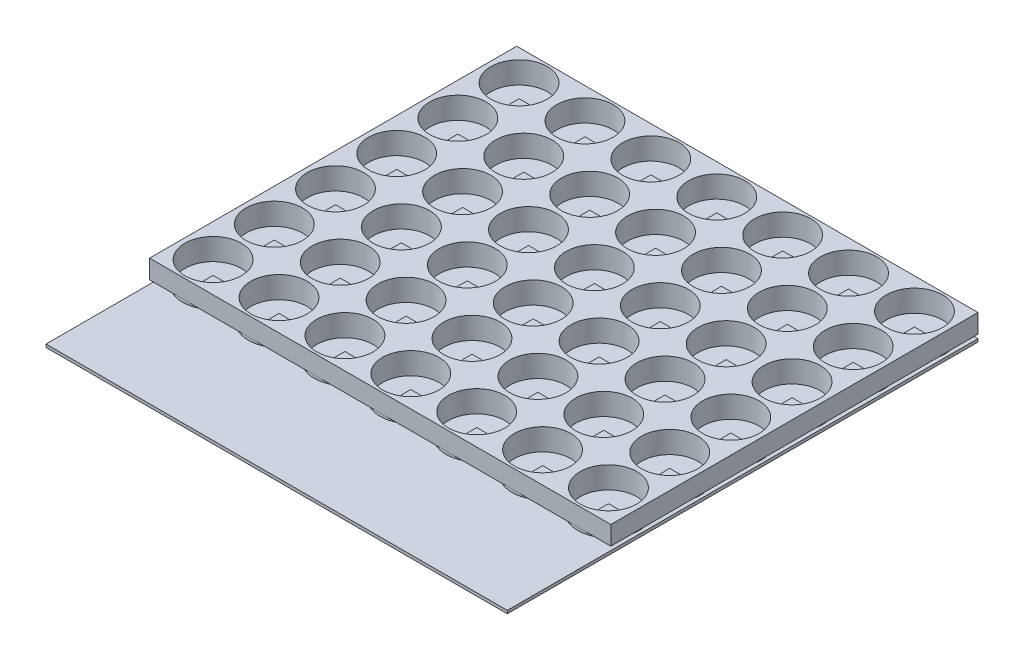
from build123d import *

# Parameters (mm, degrees)
SKETCH1_W           = 245
SKETCH1_H           = 250
BOSS_EXTRUDE1_DEPTH = 1.6
SKETCH2_W           = 5.4
SKETCH2_H           = 5.4
BOSS_EXTRUDE2_DEPTH = 2
SKETCH3_W           = 245
SKETCH3_H           = 195
SKETCH3_R           = 15
BOSS_EXTRUDE3_DEPTH = 10
SKETCH4_R           = 16.2
SKETCH4_R_2         = 15
BOSS_EXTRUDE4_DEPTH = 1.6


with BuildPart() as part:
    # Sketch1 → Boss-Extrude1 (new body)
    with BuildSketch(Plane(origin=(0, 0, 0), x_dir=(1, 0, 0), z_dir=(0, 1, 0))):
        Rectangle(SKETCH1_W, SKETCH1_H)
    extrude(amount=BOSS_EXTRUDE1_DEPTH)

    # Sketch2 → Boss-Extrude2 (add)
    with BuildSketch(Plane(origin=(0, 1.6, 0), x_dir=(1, 0, 0), z_dir=(0, 1, 0))):
        with Locations((-105, 108.75)):
            Rectangle(SKETCH2_W, SKETCH2_H)
        with Locations((-70, 108.75)):
            Rectangle(SKETCH2_W, SKETCH2_H)
        with Locations((-35, 108.75)):
            Rectangle(SKETCH2_W, SKETCH2_H)
        with Locations((0, 108.75)):
            Rectangle(SKETCH2_W, SKETCH2_H)
        with Locations((35, 108.75)):
            Rectangle(SKETCH2_W, SKETCH2_H)
        with Locations((70, 108.75)):
            Rectangle(SKETCH2_W, SKETCH2_H)
        with Locations((105, 108.75)):
            Rectangle(SKETCH2_W, SKETCH2_H)
        with Locations((-70, 76.25)):
            Rectangle(SKETCH2_W, SKETCH2_H)
        with Locations((-35, 76.25)):
            Rectangle(SKETCH2_W, SKETCH2_H)
        with Locations((0, 76.25)):
            Rectangle(SKETCH2_W, SKETCH2_H)
        with Locations((35, 76.25)):
            Rectangle(SKETCH2_W, SKETCH2_H)
        with Locations((70, 76.25)):
            Rectangle(SKETCH2_W, SKETCH2_H)
        with Locations((105, 76.25)):
            Rectangle(SKETCH2_W, SKETCH2_H)
        with Locations((-70, 43.75)):
            Rectangle(SKETCH2_W, SKETCH2_H)
        with Locations((-35, 43.75)):
            Rectangle(SKETCH2_W, SKETCH2_H)
        with Locations((0, 43.75)):
            Rectangle(SKETCH2_W, SKETCH2_H)
        with Locations((35, 43.75)):
            Rectangle(SKETCH2_W, SKETCH2_H)
        with Locations((70, 43.75)):
            Rectangle(SKETCH2_W, SKETCH2_H)
        with Locations((105, 43.75)):
            Rectangle(SKETCH2_W, SKETCH2_H)
        with Locations((-70, 11.25)):
            Rectangle(SKETCH2_W, SKETCH2_H)
        with Locations((-35, 11.25)):
            Rectangle(SKETCH2_W, SKETCH2_H)
        with Locations((0, 11.25)):
            Rectangle(SKETCH2_W, SKETCH2_H)
        with Locations((35, 11.25)):
            Rectangle(SKETCH2_W, SKETCH2_H)
        with Locations((70, 11.25)):
            Rectangle(SKETCH2_W, SKETCH2_H)
        with Locations((105, 11.25)):
            Rectangle(SKETCH2_W, SKETCH2_H)
        with Locations((-70, -21.25)):
            Rectangle(SKETCH2_W, SKETCH2_H)
        with Locations((-35, -21.25)):
            Rectangle(SKETCH2_W, SKETCH2_H)
        with Locations((0, -21.25)):
            Rectangle(SKETCH2_W, SKETCH2_H)
        with Locations((35, -21.25)):
            Rectangle(SKETCH2_W, SKETCH2_H)
        with Locations((70, -21.25)):
            Rectangle(SKETCH2_W, SKETCH2_H)
        with Locations((105, -21.25)):
            Rectangle(SKETCH2_W, SKETCH2_H)
        with Locations((-70, -53.75)):
            Rectangle(SKETCH2_W, SKETCH2_H)
        with Locations((-35, -53.75)):
            Rectangle(SKETCH2_W, SKETCH2_H)
        with Locations((0, -53.75)):
            Rectangle(SKETCH2_W, SKETCH2_H)
        with Locations((35, -53.75)):
            Rectangle(SKETCH2_W, SKETCH2_H)
        with Locations((70, -53.75)):
            Rectangle(SKETCH2_W, SKETCH2_H)
        with Locations((105, -53.75)):
            Rectangle(SKETCH2_W, SKETCH2_H)
        with Locations((-105, 76.25)):
            Rectangle(SKETCH2_W, SKETCH2_H)
        with Locations((-105, 43.75)):
            Rectangle(SKETCH2_W, SKETCH2_H)
        with Locations((-105, 11.25)):
            Rectangle(SKETCH2_W, SKETCH2_H)
        with Locations((-105, -21.25)):
            Rectangle(SKETCH2_W, SKETCH2_H)
        with Locations((-105, -53.75)):
            Rectangle(SKETCH2_W, SKETCH2_H)
    extrude(amount=BOSS_EXTRUDE2_DEPTH)


with BuildPart() as body_2:
    # Sketch3 → Boss-Extrude3 (new body)
    with BuildSketch(Plane(origin=(0, 3.6, 0), x_dir=(1, 0, 0), z_dir=(0, 1, 0))):
        with Locations((0, 27.5)):
            Rectangle(SKETCH3_W, SKETCH3_H)
        with Locations(Location((105, -53.75, 0), (0, 0, 270))):
            Circle(SKETCH3_R, mode=Mode.SUBTRACT)
        with Locations(Location((70, -53.75, 0), (0, 0, 270))):
            Circle(SKETCH3_R, mode=Mode.SUBTRACT)
        with Locations(Location((35, -53.75, 0), (0, 0, 270))):
            Circle(SKETCH3_R, mode=Mode.SUBTRACT)
        with Locations(Location((0, -53.75, 0), (0, 0, 270))):
            Circle(SKETCH3_R, mode=Mode.SUBTRACT)
        with Locations(Location((-35, -53.75, 0), (0, 0, 270))):
            Circle(SKETCH3_R, mode=Mode.SUBTRACT)
        with Locations(Location((-70, -53.75, 0), (0, 0, 270))):
            Circle(SKETCH3_R, mode=Mode.SUBTRACT)
        with Locations(Location((-105, -53.75, 0), (0, 0, 270))):
            Circle(SKETCH3_R, mode=Mode.SUBTRACT)
        with Locations(Location((70, -21.25, 0), (0, 0, 270))):
            Circle(SKETCH3_R, mode=Mode.SUBTRACT)
        with Locations(Location((35, -21.25, 0), (0, 0, 270))):
            Circle(SKETCH3_R, mode=Mode.SUBTRACT)
        with Locations(Location((0, -21.25, 0), (0, 0, 270))):
            Circle(SKETCH3_R, mode=Mode.SUBTRACT)
        with Locations(Location((-35, -21.25, 0), (0, 0, 270))):
            Circle(SKETCH3_R, mode=Mode.SUBTRACT)
        with Locations(Location((-70, -21.25, 0), (0, 0, 270))):
            Circle(SKETCH3_R, mode=Mode.SUBTRACT)
        with Locations(Location((-105, -21.25, 0), (0, 0, 270))):
            Circle(SKETCH3_R, mode=Mode.SUBTRACT)
        with Locations(Location((70, 11.25, 0), (0, 0, 270))):
            Circle(SKETCH3_R, mode=Mode.SUBTRACT)
        with Locations(Location((35, 11.25, 0), (0, 0, 270))):
            Circle(SKETCH3_R, mode=Mode.SUBTRACT)
        with Locations(Location((0, 11.25, 0), (0, 0, 270))):
            Circle(SKETCH3_R, mode=Mode.SUBTRACT)
        with Locations(Location((-35, 11.25, 0), (0, 0, 270))):
            Circle(SKETCH3_R, mode=Mode.SUBTRACT)
        with Locations(Location((-70, 11.25, 0), (0, 0, 270))):
            Circle(SKETCH3_R, mode=Mode.SUBTRACT)
        with Locations(Location((-105, 11.25, 0), (0, 0, 270))):
            Circle(SKETCH3_R, mode=Mode.SUBTRACT)
        with Locations(Location((70, 43.75, 0), (0, 0, 270))):
            Circle(SKETCH3_R, mode=Mode.SUBTRACT)
        with Locations(Location((35, 43.75, 0), (0, 0, 270))):
            Circle(SKETCH3_R, mode=Mode.SUBTRACT)
        with Locations(Location((0, 43.75, 0), (0, 0, 270))):
            Circle(SKETCH3_R, mode=Mode.SUBTRACT)
        with Locations(Location((-35, 43.75, 0), (0, 0, 270))):
            Circle(SKETCH3_R, mode=Mode.SUBTRACT)
        with Locations(Location((-70, 43.75, 0), (0, 0, 270))):
            Circle(SKETCH3_R, mode=Mode.SUBTRACT)
        with Locations(Location((-105, 43.75, 0), (0, 0, 270))):
            Circle(SKETCH3_R, mode=Mode.SUBTRACT)
        with Locations(Location((70, 76.25, 0), (0, 0, 270))):
            Circle(SKETCH3_R, mode=Mode.SUBTRACT)
        with Locations(Location((35, 76.25, 0), (0, 0, 270))):
            Circle(SKETCH3_R, mode=Mode.SUBTRACT)
        with Locations(Location((0, 76.25, 0), (0, 0, 270))):
            Circle(SKETCH3_R, mode=Mode.SUBTRACT)
        with Locations(Location((-35, 76.25, 0), (0, 0, 270))):
            Circle(SKETCH3_R, mode=Mode.SUBTRACT)
        with Locations(Location((-70, 76.25, 0), (0, 0, 270))):
            Circle(SKETCH3_R, mode=Mode.SUBTRACT)
        with Locations(Location((-105, 76.25, 0), (0, 0, 270))):
            Circle(SKETCH3_R, mode=Mode.SUBTRACT)
        with Locations(Location((70, 108.75, 0), (0, 0, 270))):
            Circle(SKETCH3_R, mode=Mode.SUBTRACT)
        with Locations(Location((35, 108.75, 0), (0, 0, 270))):
            Circle(SKETCH3_R, mode=Mode.SUBTRACT)
        with Locations(Location((0, 108.75, 0), (0, 0, 270))):
            Circle(SKETCH3_R, mode=Mode.SUBTRACT)
        with Locations(Location((-35, 108.75, 0), (0, 0, 270))):
            Circle(SKETCH3_R, mode=Mode.SUBTRACT)
        with Locations(Location((-70, 108.75, 0), (0, 0, 270))):
            Circle(SKETCH3_R, mode=Mode.SUBTRACT)
        with Locations(Location((-105, 108.75, 0), (0, 0, 270))):
            Circle(SKETCH3_R, mode=Mode.SUBTRACT)
        with Locations(Location((105, -21.25, 0), (0, 0, 270))):
            Circle(SKETCH3_R, mode=Mode.SUBTRACT)
        with Locations(Location((105, 11.25, 0), (0, 0, 270))):
            Circle(SKETCH3_R, mode=Mode.SUBTRACT)
        with Locations(Location((105, 43.75, 0), (0, 0, 270))):
            Circle(SKETCH3_R, mode=Mode.SUBTRACT)
        with Locations(Location((105, 76.25, 0), (0, 0, 270))):
            Circle(SKETCH3_R, mode=Mode.SUBTRACT)
        with Locations(Location((105, 108.75, 0), (0, 0, 270))):
            Circle(SKETCH3_R, mode=Mode.SUBTRACT)
    extrude(amount=BOSS_EXTRUDE3_DEPTH)

    # Sketch4 → Boss-Extrude4 (add)
    # profile 1 of 42: a face of its own
    with BuildSketch(Plane(origin=(0, 3.6, 0), x_dir=(-1, 0, 0), z_dir=(0, -1, 0))):
        with Locations(Location((105, 108.75, 0), (0, 0, 270))):
            Circle(SKETCH4_R)
        with Locations(Location((105, 108.75, 0), (0, 0, 90))):
            Circle(SKETCH4_R_2, mode=Mode.SUBTRACT)
    # profile 2 of 42: a face of its own
    with BuildSketch(Plane(origin=(0, 3.6, 0), x_dir=(-1, 0, 0), z_dir=(0, -1, 0))):
        with Locations(Location((70, 108.75, 0), (0, 0, 270))):
            Circle(SKETCH4_R)
        with Locations(Location((70, 108.75, 0), (0, 0, 90))):
            Circle(SKETCH4_R_2, mode=Mode.SUBTRACT)
    # profile 3 of 42: a face of its own
    with BuildSketch(Plane(origin=(0, 3.6, 0), x_dir=(-1, 0, 0), z_dir=(0, -1, 0))):
        with Locations(Location((35, 108.75, 0), (0, 0, 270))):
            Circle(SKETCH4_R)
        with Locations(Location((35, 108.75, 0), (0, 0, 90))):
            Circle(SKETCH4_R_2, mode=Mode.SUBTRACT)
    # profile 4 of 42: a face of its own
    with BuildSketch(Plane(origin=(0, 3.6, 0), x_dir=(-1, 0, 0), z_dir=(0, -1, 0))):
        with Locations(Location((0, 108.75, 0), (0, 0, 270))):
            Circle(SKETCH4_R)
        with Locations(Location((0, 108.75, 0), (0, 0, 90))):
            Circle(SKETCH4_R_2, mode=Mode.SUBTRACT)
    # profile 5 of 42: a face of its own
    with BuildSketch(Plane(origin=(0, 3.6, 0), x_dir=(-1, 0, 0), z_dir=(0, -1, 0))):
        with Locations(Location((-35, 108.75, 0), (0, 0, 270))):
            Circle(SKETCH4_R)
        with Locations(Location((-35, 108.75, 0), (0, 0, 90))):
            Circle(SKETCH4_R_2, mode=Mode.SUBTRACT)
    # profile 6 of 42: a face of its own
    with BuildSketch(Plane(origin=(0, 3.6, 0), x_dir=(-1, 0, 0), z_dir=(0, -1, 0))):
        with Locations(Location((-70, 108.75, 0), (0, 0, 270))):
            Circle(SKETCH4_R)
        with Locations(Location((-70, 108.75, 0), (0, 0, 90))):
            Circle(SKETCH4_R_2, mode=Mode.SUBTRACT)
    # profile 7 of 42: a face of its own
    with BuildSketch(Plane(origin=(0, 3.6, 0), x_dir=(-1, 0, 0), z_dir=(0, -1, 0))):
        with Locations(Location((-105, 108.75, 0), (0, 0, 270))):
            Circle(SKETCH4_R)
        with Locations(Location((-105, 108.75, 0), (0, 0, 90))):
            Circle(SKETCH4_R_2, mode=Mode.SUBTRACT)
    # profile 8 of 42: a face of its own
    with BuildSketch(Plane(origin=(0, 3.6, 0), x_dir=(-1, 0, 0), z_dir=(0, -1, 0))):
        with Locations(Location((70, 76.25, 0), (0, 0, 270))):
            Circle(SKETCH4_R)
        with Locations(Location((70, 76.25, 0), (0, 0, 90))):
            Circle(SKETCH4_R_2, mode=Mode.SUBTRACT)
    # profile 9 of 42: a face of its own
    with BuildSketch(Plane(origin=(0, 3.6, 0), x_dir=(-1, 0, 0), z_dir=(0, -1, 0))):
        with Locations(Location((35, 76.25, 0), (0, 0, 270))):
            Circle(SKETCH4_R)
        with Locations(Location((35, 76.25, 0), (0, 0, 90))):
            Circle(SKETCH4_R_2, mode=Mode.SUBTRACT)
    # profile 10 of 42: a face of its own
    with BuildSketch(Plane(origin=(0, 3.6, 0), x_dir=(-1, 0, 0), z_dir=(0, -1, 0))):
        with Locations(Location((0, 76.25, 0), (0, 0, 270))):
            Circle(SKETCH4_R)
        with Locations(Location((0, 76.25, 0), (0, 0, 90))):
            Circle(SKETCH4_R_2, mode=Mode.SUBTRACT)
    # profile 11 of 42: a face of its own
    with BuildSketch(Plane(origin=(0, 3.6, 0), x_dir=(-1, 0, 0), z_dir=(0, -1, 0))):
        with Locations(Location((-35, 76.25, 0), (0, 0, 270))):
            Circle(SKETCH4_R)
        with Locations(Location((-35, 76.25, 0), (0, 0, 90))):
            Circle(SKETCH4_R_2, mode=Mode.SUBTRACT)
    # profile 12 of 42: a face of its own
    with BuildSketch(Plane(origin=(0, 3.6, 0), x_dir=(-1, 0, 0), z_dir=(0, -1, 0))):
        with Locations(Location((-70, 76.25, 0), (0, 0, 270))):
            Circle(SKETCH4_R)
        with Locations(Location((-70, 76.25, 0), (0, 0, 90))):
            Circle(SKETCH4_R_2, mode=Mode.SUBTRACT)
    # profile 13 of 42: a face of its own
    with BuildSketch(Plane(origin=(0, 3.6, 0), x_dir=(-1, 0, 0), z_dir=(0, -1, 0))):
        with Locations(Location((-105, 76.25, 0), (0, 0, 270))):
            Circle(SKETCH4_R)
        with Locations(Location((-105, 76.25, 0), (0, 0, 90))):
            Circle(SKETCH4_R_2, mode=Mode.SUBTRACT)
    # profile 14 of 42: a face of its own
    with BuildSketch(Plane(origin=(0, 3.6, 0), x_dir=(-1, 0, 0), z_dir=(0, -1, 0))):
        with Locations(Location((70, 43.75, 0), (0, 0, 270))):
            Circle(SKETCH4_R)
        with Locations(Location((70, 43.75, 0), (0, 0, 90))):
            Circle(SKETCH4_R_2, mode=Mode.SUBTRACT)
    # profile 15 of 42: a face of its own
    with BuildSketch(Plane(origin=(0, 3.6, 0), x_dir=(-1, 0, 0), z_dir=(0, -1, 0))):
        with Locations(Location((35, 43.75, 0), (0, 0, 270))):
            Circle(SKETCH4_R)
        with Locations(Location((35, 43.75, 0), (0, 0, 90))):
            Circle(SKETCH4_R_2, mode=Mode.SUBTRACT)
    # profile 16 of 42: a face of its own
    with BuildSketch(Plane(origin=(0, 3.6, 0), x_dir=(-1, 0, 0), z_dir=(0, -1, 0))):
        with Locations(Location((0, 43.75, 0), (0, 0, 270))):
            Circle(SKETCH4_R)
        with Locations(Location((0, 43.75, 0), (0, 0, 90))):
            Circle(SKETCH4_R_2, mode=Mode.SUBTRACT)
    # profile 17 of 42: a face of its own
    with BuildSketch(Plane(origin=(0, 3.6, 0), x_dir=(-1, 0, 0), z_dir=(0, -1, 0))):
        with Locations(Location((-35, 43.75, 0), (0, 0, 270))):
            Circle(SKETCH4_R)
        with Locations(Location((-35, 43.75, 0), (0, 0, 90))):
            Circle(SKETCH4_R_2, mode=Mode.SUBTRACT)
    # profile 18 of 42: a face of its own
    with BuildSketch(Plane(origin=(0, 3.6, 0), x_dir=(-1, 0, 0), z_dir=(0, -1, 0))):
        with Locations(Location((-70, 43.75, 0), (0, 0, 270))):
            Circle(SKETCH4_R)
        with Locations(Location((-70, 43.75, 0), (0, 0, 90))):
            Circle(SKETCH4_R_2, mode=Mode.SUBTRACT)
    # profile 19 of 42: a face of its own
    with BuildSketch(Plane(origin=(0, 3.6, 0), x_dir=(-1, 0, 0), z_dir=(0, -1, 0))):
        with Locations(Location((-105, 43.75, 0), (0, 0, 270))):
            Circle(SKETCH4_R)
        with Locations(Location((-105, 43.75, 0), (0, 0, 90))):
            Circle(SKETCH4_R_2, mode=Mode.SUBTRACT)
    # profile 20 of 42: a face of its own
    with BuildSketch(Plane(origin=(0, 3.6, 0), x_dir=(-1, 0, 0), z_dir=(0, -1, 0))):
        with Locations(Location((70, 11.25, 0), (0, 0, 270))):
            Circle(SKETCH4_R)
        with Locations(Location((70, 11.25, 0), (0, 0, 90))):
            Circle(SKETCH4_R_2, mode=Mode.SUBTRACT)
    # profile 21 of 42: a face of its own
    with BuildSketch(Plane(origin=(0, 3.6, 0), x_dir=(-1, 0, 0), z_dir=(0, -1, 0))):
        with Locations(Location((35, 11.25, 0), (0, 0, 270))):
            Circle(SKETCH4_R)
        with Locations(Location((35, 11.25, 0), (0, 0, 90))):
            Circle(SKETCH4_R_2, mode=Mode.SUBTRACT)
    # profile 22 of 42: a face of its own
    with BuildSketch(Plane(origin=(0, 3.6, 0), x_dir=(-1, 0, 0), z_dir=(0, -1, 0))):
        with Locations(Location((0, 11.25, 0), (0, 0, 270))):
            Circle(SKETCH4_R)
        with Locations(Location((0, 11.25, 0), (0, 0, 90))):
            Circle(SKETCH4_R_2, mode=Mode.SUBTRACT)
    # profile 23 of 42: a face of its own
    with BuildSketch(Plane(origin=(0, 3.6, 0), x_dir=(-1, 0, 0), z_dir=(0, -1, 0))):
        with Locations(Location((-35, 11.25, 0), (0, 0, 270))):
            Circle(SKETCH4_R)
        with Locations(Location((-35, 11.25, 0), (0, 0, 90))):
            Circle(SKETCH4_R_2, mode=Mode.SUBTRACT)
    # profile 24 of 42: a face of its own
    with BuildSketch(Plane(origin=(0, 3.6, 0), x_dir=(-1, 0, 0), z_dir=(0, -1, 0))):
        with Locations(Location((-70, 11.25, 0), (0, 0, 270))):
            Circle(SKETCH4_R)
        with Locations(Location((-70, 11.25, 0), (0, 0, 90))):
            Circle(SKETCH4_R_2, mode=Mode.SUBTRACT)
    # profile 25 of 42: a face of its own
    with BuildSketch(Plane(origin=(0, 3.6, 0), x_dir=(-1, 0, 0), z_dir=(0, -1, 0))):
        with Locations(Location((-105, 11.25, 0), (0, 0, 270))):
            Circle(SKETCH4_R)
        with Locations(Location((-105, 11.25, 0), (0, 0, 90))):
            Circle(SKETCH4_R_2, mode=Mode.SUBTRACT)
    # profile 26 of 42: a face of its own
    with BuildSketch(Plane(origin=(0, 3.6, 0), x_dir=(-1, 0, 0), z_dir=(0, -1, 0))):
        with Locations(Location((70, -21.25, 0), (0, 0, 270))):
            Circle(SKETCH4_R)
        with Locations(Location((70, -21.25, 0), (0, 0, 90))):
            Circle(SKETCH4_R_2, mode=Mode.SUBTRACT)
    # profile 27 of 42: a face of its own
    with BuildSketch(Plane(origin=(0, 3.6, 0), x_dir=(-1, 0, 0), z_dir=(0, -1, 0))):
        with Locations(Location((35, -21.25, 0), (0, 0, 270))):
            Circle(SKETCH4_R)
        with Locations(Location((35, -21.25, 0), (0, 0, 90))):
            Circle(SKETCH4_R_2, mode=Mode.SUBTRACT)
    # profile 28 of 42: a face of its own
    with BuildSketch(Plane(origin=(0, 3.6, 0), x_dir=(-1, 0, 0), z_dir=(0, -1, 0))):
        with Locations(Location((0, -21.25, 0), (0, 0, 270))):
            Circle(SKETCH4_R)
        with Locations(Location((0, -21.25, 0), (0, 0, 90))):
            Circle(SKETCH4_R_2, mode=Mode.SUBTRACT)
    # profile 29 of 42: a face of its own
    with BuildSketch(Plane(origin=(0, 3.6, 0), x_dir=(-1, 0, 0), z_dir=(0, -1, 0))):
        with Locations(Location((-35, -21.25, 0), (0, 0, 270))):
            Circle(SKETCH4_R)
        with Locations(Location((-35, -21.25, 0), (0, 0, 90))):
            Circle(SKETCH4_R_2, mode=Mode.SUBTRACT)
    # profile 30 of 42: a face of its own
    with BuildSketch(Plane(origin=(0, 3.6, 0), x_dir=(-1, 0, 0), z_dir=(0, -1, 0))):
        with Locations(Location((-70, -21.25, 0), (0, 0, 270))):
            Circle(SKETCH4_R)
        with Locations(Location((-70, -21.25, 0), (0, 0, 90))):
            Circle(SKETCH4_R_2, mode=Mode.SUBTRACT)
    # profile 31 of 42: a face of its own
    with BuildSketch(Plane(origin=(0, 3.6, 0), x_dir=(-1, 0, 0), z_dir=(0, -1, 0))):
        with Locations(Location((-105, -21.25, 0), (0, 0, 270))):
            Circle(SKETCH4_R)
        with Locations(Location((-105, -21.25, 0), (0, 0, 90))):
            Circle(SKETCH4_R_2, mode=Mode.SUBTRACT)
    # profile 32 of 42: a face of its own
    with BuildSketch(Plane(origin=(0, 3.6, 0), x_dir=(-1, 0, 0), z_dir=(0, -1, 0))):
        with Locations(Location((70, -53.75, 0), (0, 0, 270))):
            Circle(SKETCH4_R)
        with Locations(Location((70, -53.75, 0), (0, 0, 90))):
            Circle(SKETCH4_R_2, mode=Mode.SUBTRACT)
    # profile 33 of 42: a face of its own
    with BuildSketch(Plane(origin=(0, 3.6, 0), x_dir=(-1, 0, 0), z_dir=(0, -1, 0))):
        with Locations(Location((35, -53.75, 0), (0, 0, 270))):
            Circle(SKETCH4_R)
        with Locations(Location((35, -53.75, 0), (0, 0, 90))):
            Circle(SKETCH4_R_2, mode=Mode.SUBTRACT)
    # profile 34 of 42: a face of its own
    with BuildSketch(Plane(origin=(0, 3.6, 0), x_dir=(-1, 0, 0), z_dir=(0, -1, 0))):
        with Locations(Location((0, -53.75, 0), (0, 0, 270))):
            Circle(SKETCH4_R)
        with Locations(Location((0, -53.75, 0), (0, 0, 90))):
            Circle(SKETCH4_R_2, mode=Mode.SUBTRACT)
    # profile 35 of 42: a face of its own
    with BuildSketch(Plane(origin=(0, 3.6, 0), x_dir=(-1, 0, 0), z_dir=(0, -1, 0))):
        with Locations(Location((-35, -53.75, 0), (0, 0, 270))):
            Circle(SKETCH4_R)
        with Locations(Location((-35, -53.75, 0), (0, 0, 90))):
            Circle(SKETCH4_R_2, mode=Mode.SUBTRACT)
    # profile 36 of 42: a face of its own
    with BuildSketch(Plane(origin=(0, 3.6, 0), x_dir=(-1, 0, 0), z_dir=(0, -1, 0))):
        with Locations(Location((-70, -53.75, 0), (0, 0, 270))):
            Circle(SKETCH4_R)
        with Locations(Location((-70, -53.75, 0), (0, 0, 90))):
            Circle(SKETCH4_R_2, mode=Mode.SUBTRACT)
    # profile 37 of 42: a face of its own
    with BuildSketch(Plane(origin=(0, 3.6, 0), x_dir=(-1, 0, 0), z_dir=(0, -1, 0))):
        with Locations(Location((-105, -53.75, 0), (0, 0, 270))):
            Circle(SKETCH4_R)
        with Locations(Location((-105, -53.75, 0), (0, 0, 90))):
            Circle(SKETCH4_R_2, mode=Mode.SUBTRACT)
    # profile 38 of 42: a face of its own
    with BuildSketch(Plane(origin=(0, 3.6, 0), x_dir=(-1, 0, 0), z_dir=(0, -1, 0))):
        with Locations(Location((105, 76.25, 0), (0, 0, 270))):
            Circle(SKETCH4_R)
        with Locations(Location((105, 76.25, 0), (0, 0, 90))):
            Circle(SKETCH4_R_2, mode=Mode.SUBTRACT)
    # profile 39 of 42: a face of its own
    with BuildSketch(Plane(origin=(0, 3.6, 0), x_dir=(-1, 0, 0), z_dir=(0, -1, 0))):
        with Locations(Location((105, 43.75, 0), (0, 0, 270))):
            Circle(SKETCH4_R)
        with Locations(Location((105, 43.75, 0), (0, 0, 90))):
            Circle(SKETCH4_R_2, mode=Mode.SUBTRACT)
    # profile 40 of 42: a face of its own
    with BuildSketch(Plane(origin=(0, 3.6, 0), x_dir=(-1, 0, 0), z_dir=(0, -1, 0))):
        with Locations(Location((105, 11.25, 0), (0, 0, 270))):
            Circle(SKETCH4_R)
        with Locations(Location((105, 11.25, 0), (0, 0, 90))):
            Circle(SKETCH4_R_2, mode=Mode.SUBTRACT)
    # profile 41 of 42: a face of its own
    with BuildSketch(Plane(origin=(0, 3.6, 0), x_dir=(-1, 0, 0), z_dir=(0, -1, 0))):
        with Locations(Location((105, -21.25, 0), (0, 0, 270))):
            Circle(SKETCH4_R)
        with Locations(Location((105, -21.25, 0), (0, 0, 90))):
            Circle(SKETCH4_R_2, mode=Mode.SUBTRACT)
    # profile 42 of 42: a face of its own
    with BuildSketch(Plane(origin=(0, 3.6, 0), x_dir=(-1, 0, 0), z_dir=(0, -1, 0))):
        with Locations(Location((105, -53.75, 0), (0, 0, 270))):
            Circle(SKETCH4_R)
        with Locations(Location((105, -53.75, 0), (0, 0, 90))):
            Circle(SKETCH4_R_2, mode=Mode.SUBTRACT)
    extrude(amount=BOSS_EXTRUDE4_DEPTH)


solid = Compound([part.part, body_2.part])
